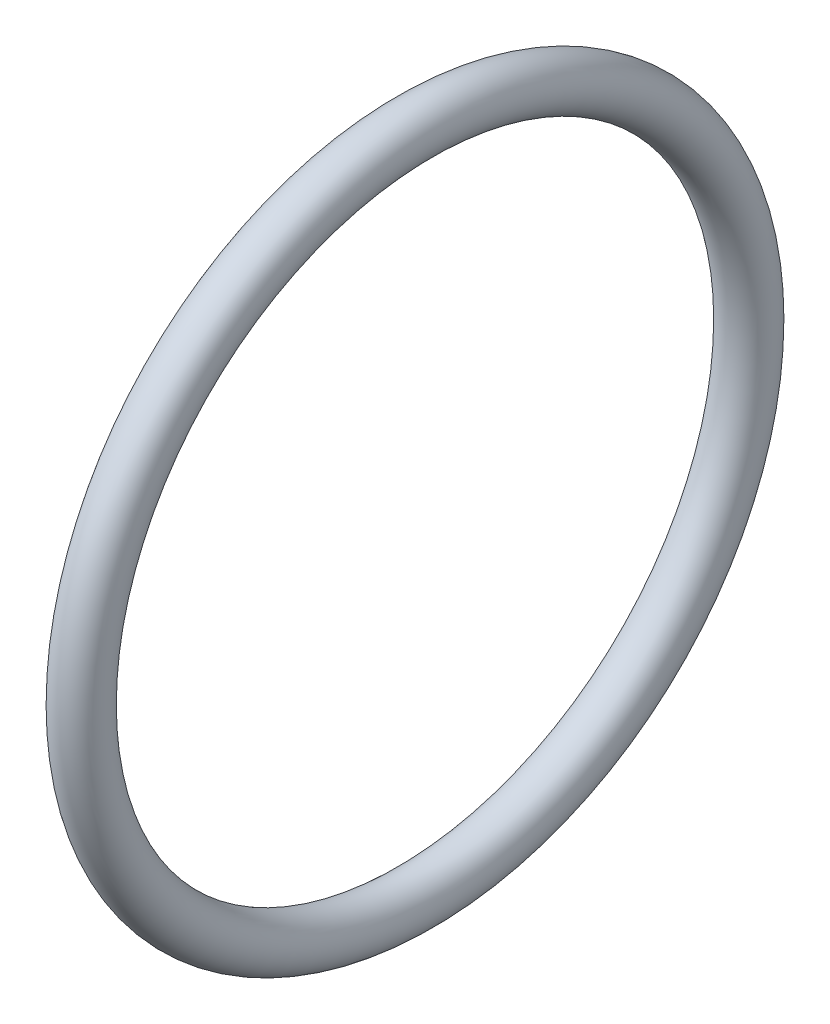
from build123d import *

# Parameters (mm, degrees)
SKETCH_1_R = 1.6


with BuildPart() as part:
    # 草图1 → 旋转1 (revolve)
    with BuildSketch(Plane.XY, mode=Mode.PRIVATE) as revolve_1_sk:
        with Locations((0, 21.5)):
            Circle(SKETCH_1_R)
    revolve(revolve_1_sk.sketch.rotate(Axis((0, 0, 0), (1, 0, 0)), 90), axis=Axis((0, 0, 0), (1, 0, 0)))


solid = part.part
